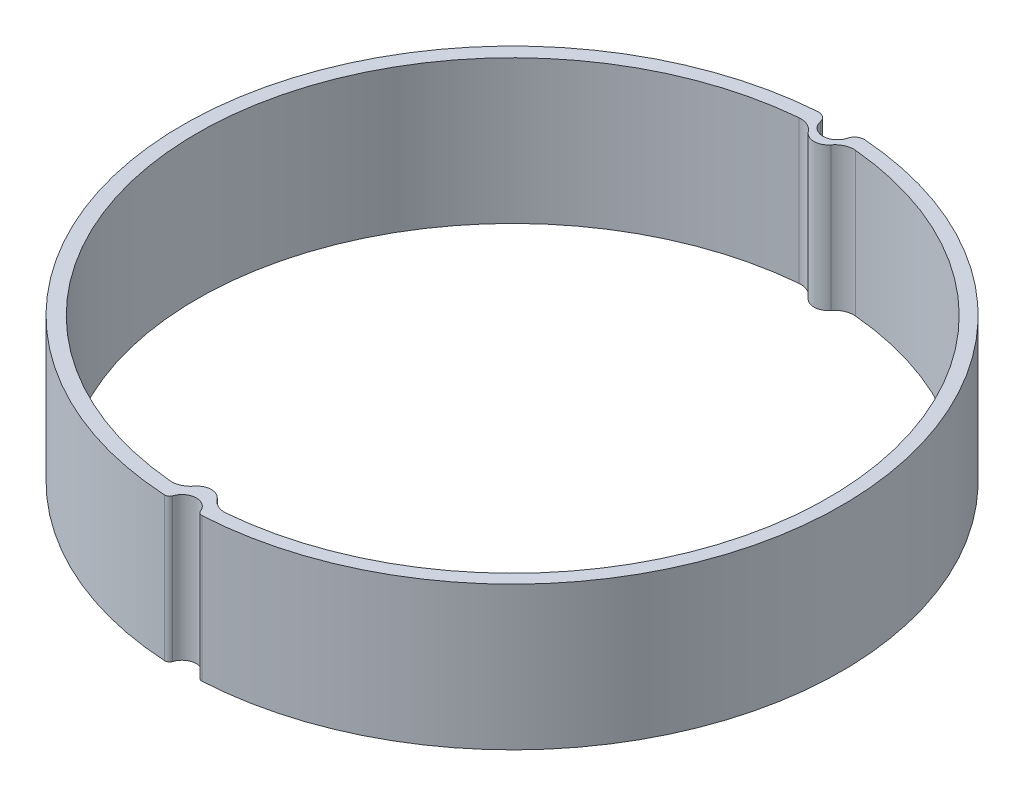
from build123d import *

# Parameters (mm, degrees)
BOSS_EXTRUDE1_DEPTH = 15
CUT_EXTRUDE2_DEPTH  = 52.002935676


with BuildPart() as part:
    # Sketch1 → Boss-Extrude1 (new body)
    with BuildSketch(Plane(origin=(0, 0, 0), x_dir=(1, 0, 0), z_dir=(0, 1, 0))):
        with BuildLine():
            ThreePointArc((1.388184439, -34.024526654), (1.582903075, -34.267692689), (1.883792339, -34.348381715))
            ThreePointArc((1.883792339, -34.348381715), (24.448065102, -24.200250262), (34.365790759, -1.53376189))
            ThreePointArc((34.365790759, -1.53376189), (25.706615752, 22.858913066), (2.493104989, 34.309538433))
            ThreePointArc((2.493104989, 34.309538433), (1.837317334, 34.124415112), (1.452378604, 33.562142698))
            ThreePointArc((1.452378604, 33.562142698), (-0.029391592, 32.437392534), (-1.46595483, 33.619336656))
            ThreePointArc((-1.46595483, 33.619336656), (-1.844328043, 34.20829277), (-2.516198277, 34.404827707))
            ThreePointArc((-2.516198277, 34.404827707), (-25.784489967, 22.916882433), (-34.462378171, -1.538802818))
            ThreePointArc((-34.462378171, -1.538802818), (-24.537991164, -24.246863982), (-1.949992086, -34.441558533))
            ThreePointArc((-1.949992086, -34.441558533), (-1.638342507, -34.354295246), (-1.445420769, -34.094446164))
            ThreePointArc((-1.445420769, -34.094446164), (-0.053498551, -33.05116711), (1.388184439, -34.024526654))
        make_face()
        with BuildLine():
            Line((-2.417, 3.18717916), (0, 3.18717916))
            Line((0, 3.18717916), (2.417, 3.18717916))
            ThreePointArc((2.417, 3.18717916), (0, -4), (-2.417, 3.18717916))
        make_face(mode=Mode.SUBTRACT)
    extrude(amount=BOSS_EXTRUDE1_DEPTH)

    # Sketch2 → Cut-Extrude2 (cut, through all)
    with BuildSketch(Plane(origin=(0, 0, 0), x_dir=(1, 0, 0), z_dir=(0, 1, 0))):
        with BuildLine():
            ThreePointArc((-32.866935484, -2.96049859), (-23.334523779, -23.334523779), (-2.96049859, -32.866935484))
            ThreePointArc((-2.96049859, -32.866935484), (-1.9760642, -32.705835472), (-1.191889043, -32.089285714))
            ThreePointArc((-1.191889043, -32.089285714), (0, -31.5), (1.191889043, -32.089285714))
            ThreePointArc((1.191889043, -32.089285714), (1.9760642, -32.705835472), (2.96049859, -32.866935484))
            ThreePointArc((2.96049859, -32.866935484), (23.334523779, -23.334523779), (32.866935484, -2.96049859))
            ThreePointArc((32.866935484, -2.96049859), (25.333821586, 21.147044329), (2.96049859, 32.866935484))
            ThreePointArc((2.96049859, 32.866935484), (1.9760642, 32.705835472), (1.191889043, 32.089285714))
            ThreePointArc((1.191889043, 32.089285714), (0, 31.5), (-1.191889043, 32.089285714))
            ThreePointArc((-1.191889043, 32.089285714), (-1.9760642, 32.705835472), (-2.96049859, 32.866935484))
            ThreePointArc((-2.96049859, 32.866935484), (-25.333821586, 21.147044329), (-32.866935484, -2.96049859))
        make_face()
    extrude(amount=CUT_EXTRUDE2_DEPTH, mode=Mode.SUBTRACT)


solid = part.part
